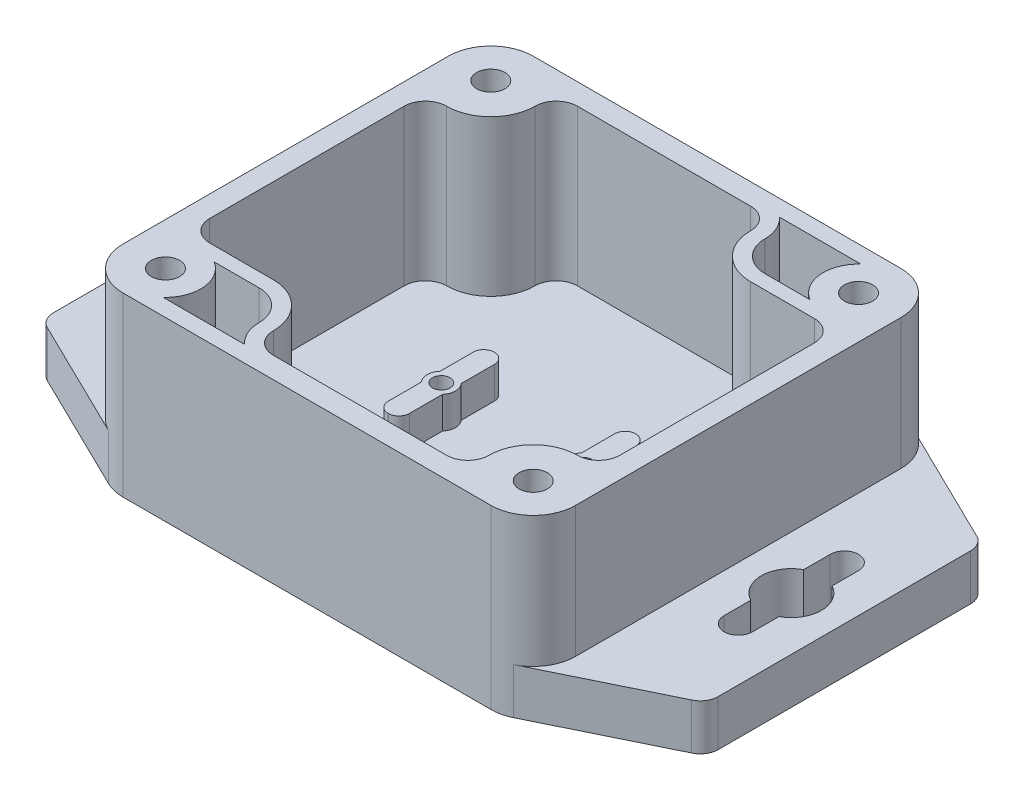
from build123d import *

# Parameters (mm, degrees)
EXTRUDE_1_DEPTH   = 6.5
EXTRUDE_1_2_DEPTH = 6.5
SKETCH_1_3_R      = 2
EXTRUDE_2_DEPTH   = 25
EXTRUDE_3_DEPTH   = 3
SKETCH_1_13_R     = 1.25
EXTRUDE_8_DEPTH   = 7.5
SKETCH_1_12_R     = 1.25
EXTRUDE_7_DEPTH   = 7.5


with BuildPart() as part:
    # Эскиз1 → Бобышка-Вытянуть1 (new body)
    with BuildSketch(Plane(origin=(0, 0, 0), x_dir=(1, 0, 0), z_dir=(0, 1, 0))):
        with BuildLine():
            ThreePointArc((-32, 23), (-31.089439395, 26.177673149), (-28.63413112, 28.390858303))
            Line((-28.63413112, 28.390858303), (-45.533328715, 20.133415836))
            ThreePointArc((-45.533328715, 20.133415836), (-46.601585329, 19.210972795), (-47, 17.856964263))
            Line((-47, 17.856964263), (-47, -17.856964263))
            ThreePointArc((-47, -17.856964263), (-46.601585329, -19.210972795), (-45.533328715, -20.133415836))
            Line((-45.533328715, -20.133415836), (-28.63413112, -28.390858303))
            ThreePointArc((-28.63413112, -28.390858303), (-31.089439395, -26.177673149), (-32, -23))
            Line((-32, -23), (-32, 23))
        make_face()
        with BuildLine():
            Line((-41.5, -7.5), (-41.5, -3.75))
            ThreePointArc((-41.5, -3.75), (-43.75, 0), (-41.5, 3.75))
            Line((-41.5, 3.75), (-41.5, 7.5))
            ThreePointArc((-41.5, 7.5), (-39.5, 9.5), (-37.5, 7.5))
            Line((-37.5, 7.5), (-37.5, 3.75))
            ThreePointArc((-37.5, 3.75), (-35.25, 0), (-37.5, -3.75))
            Line((-37.5, -3.75), (-37.5, -7.5))
            ThreePointArc((-37.5, -7.5), (-39.5, -9.5), (-41.5, -7.5))
        make_face(mode=Mode.SUBTRACT)
    extrude(amount=EXTRUDE_1_DEPTH)



with BuildPart() as body_2:
    # Эскиз1 → Extrude 1 2 (new body)
    with BuildSketch(Plane(origin=(0, 0, 0), x_dir=(1, 0, 0), z_dir=(0, 1, 0))):
        with BuildLine():
            Line((45.533328715, 20.133415836), (28.63413112, 28.390858303))
            ThreePointArc((28.63413112, 28.390858303), (31.089439395, 26.177673149), (32, 23))
            Line((32, 23), (32, -23))
            ThreePointArc((32, -23), (31.089439395, -26.177673149), (28.63413112, -28.390858303))
            Line((28.63413112, -28.390858303), (45.533328715, -20.133415836))
            ThreePointArc((45.533328715, -20.133415836), (46.601585329, -19.210972795), (47, -17.856964263))
            Line((47, -17.856964263), (47, 17.856964263))
            ThreePointArc((47, 17.856964263), (46.601585329, 19.210972795), (45.533328715, 20.133415836))
        make_face()
        with BuildLine():
            Line((37.5, -7.5), (37.5, -3.75))
            ThreePointArc((37.5, -3.75), (35.25, 0), (37.5, 3.75))
            Line((37.5, 3.75), (37.5, 7.5))
            ThreePointArc((37.5, 7.5), (39.5, 9.5), (41.5, 7.5))
            Line((41.5, 7.5), (41.5, 3.75))
            ThreePointArc((41.5, 3.75), (43.75, 0), (41.5, -3.75))
            Line((41.5, -3.75), (41.5, -7.5))
            ThreePointArc((41.5, -7.5), (39.5, -9.5), (37.5, -7.5))
        make_face(mode=Mode.SUBTRACT)
    extrude(amount=EXTRUDE_1_2_DEPTH)


with BuildPart() as part_1:
    add(part.part)

    add(body_2.part)  # Бобышка-Вытянуть2 merges body 2
    # Эскиз1<3> → Бобышка-Вытянуть2 (add)
    with BuildSketch(Plane(origin=(0, 0, 0), x_dir=(1, 0, 0), z_dir=(0, 1, 0))):
        with BuildLine():
            Line((26, 29), (-26, 29))
            ThreePointArc((-26, 29), (-27.351822877, 28.845731341), (-28.63413112, 28.390858303))
            ThreePointArc((-28.63413112, 28.390858303), (-31.089439395, 26.177673149), (-32, 23))
            Line((-32, 23), (-32, -23))
            ThreePointArc((-32, -23), (-31.089439395, -26.177673149), (-28.63413112, -28.390858303))
            ThreePointArc((-28.63413112, -28.390858303), (-27.351822877, -28.845731341), (-26, -29))
            Line((-26, -29), (26, -29))
            ThreePointArc((26, -29), (27.351822877, -28.845731341), (28.63413112, -28.390858303))
            ThreePointArc((28.63413112, -28.390858303), (31.089439395, -26.177673149), (32, -23))
            Line((32, -23), (32, 23))
            ThreePointArc((32, 23), (31.089439395, 26.177673149), (28.63413112, 28.390858303))
            ThreePointArc((28.63413112, 28.390858303), (27.351822877, 28.845731341), (26, 29))
        make_face()
        with Locations((-26, -23)):
            Circle(SKETCH_1_3_R, mode=Mode.SUBTRACT)
        with BuildLine():
            Line((-11.113034344, -26.7), (-22.636965656, -26.7))
            ThreePointArc((-22.636965656, -26.7), (-21.020896599, -22.543349889), (-23.366086562, -18.75))
            Line((-23.366086562, -18.75), (-17, -18.75))
            ThreePointArc((-17, -18.75), (-13.99479618, -19.99479618), (-12.75, -23))
            ThreePointArc((-12.75, -23), (-12.322481368, -25.022971611), (-11.113034344, -26.7))
        make_face(mode=Mode.SUBTRACT)
        with Locations((26, -23)):
            Circle(SKETCH_1_3_R, mode=Mode.SUBTRACT)
        with BuildLine():
            Line((-16.75, 26), (7.75, 26))
            ThreePointArc((7.75, 26), (9.871320344, 25.121320344), (10.75, 23))
            ThreePointArc((10.75, 23), (12.580582618, 18.580582618), (17, 16.75))
            Line((17, 16.75), (26, 16.75))
            ThreePointArc((26, 16.75), (28.121320344, 15.871320344), (29, 13.75))
            Line((29, 13.75), (29, -13.75))
            ThreePointArc((29, -13.75), (28.121320344, -15.871320344), (26, -16.75))
            ThreePointArc((26, -16.75), (21.580582618, -18.580582618), (19.75, -23))
            ThreePointArc((19.75, -23), (18.871320344, -25.121320344), (16.75, -26))
            Line((16.75, -26), (-7.75, -26))
            ThreePointArc((-7.75, -26), (-9.871320344, -25.121320344), (-10.75, -23))
            ThreePointArc((-10.75, -23), (-12.580582618, -18.580582618), (-17, -16.75))
            Line((-17, -16.75), (-26, -16.75))
            ThreePointArc((-26, -16.75), (-28.121320344, -15.871320344), (-29, -13.75))
            Line((-29, -13.75), (-29, 13.75))
            ThreePointArc((-29, 13.75), (-28.121320344, 15.871320344), (-26, 16.75))
            ThreePointArc((-26, 16.75), (-21.580582618, 18.580582618), (-19.75, 23))
            ThreePointArc((-19.75, 23), (-18.871320344, 25.121320344), (-16.75, 26))
        make_face(mode=Mode.SUBTRACT)
        with Locations((-26, 23)):
            Circle(SKETCH_1_3_R, mode=Mode.SUBTRACT)
        with BuildLine():
            Line((23.366086562, 18.75), (17, 18.75))
            ThreePointArc((17, 18.75), (13.99479618, 19.99479618), (12.75, 23))
            ThreePointArc((12.75, 23), (12.322481368, 25.022971611), (11.113034344, 26.7))
            Line((11.113034344, 26.7), (22.636965656, 26.7))
            ThreePointArc((22.636965656, 26.7), (21.020896599, 22.543349889), (23.366086562, 18.75))
        make_face(mode=Mode.SUBTRACT)
        with Locations((26, 23)):
            Circle(SKETCH_1_3_R, mode=Mode.SUBTRACT)
    extrude(amount=EXTRUDE_2_DEPTH)

    # Эскиз1<4> → Бобышка-Вытянуть3 (add)
    with BuildSketch(Plane(origin=(0, 0, 0), x_dir=(1, 0, 0), z_dir=(0, 1, 0))):
        with BuildLine():
            Line((26, 29), (-26, 29))
            ThreePointArc((-26, 29), (-30.242640687, 27.242640687), (-32, 23))
            Line((-32, 23), (-32, -23))
            ThreePointArc((-32, -23), (-30.242640687, -27.242640687), (-26, -29))
            Line((-26, -29), (26, -29))
            ThreePointArc((26, -29), (30.242640687, -27.242640687), (32, -23))
            Line((32, -23), (32, 23))
            ThreePointArc((32, 23), (30.242640687, 27.242640687), (26, 29))
        make_face()
    extrude(amount=EXTRUDE_3_DEPTH)

    # Эскиз1<13> → Бобышка-Вытянуть8 (add)
    # profile 1 of 2: a face of its own
    with BuildSketch(Plane(origin=(0, 0, 0), x_dir=(1, 0, 0), z_dir=(0, 1, 0))):
        with BuildLine():
            Line((-11.5, 1.322875656), (-11.5, 6.01))
            ThreePointArc((-11.5, 6.01), (-11.063589104, 7.063589104), (-10.01, 7.5))
            Line((-10.01, 7.5), (-9.99, 7.5))
            ThreePointArc((-9.99, 7.5), (-8.936410896, 7.063589104), (-8.5, 6.01))
            Line((-8.5, 6.01), (-8.5, 1.322875656))
            ThreePointArc((-8.5, 1.322875656), (-8, 0), (-8.5, -1.322875656))
            Line((-8.5, -1.322875656), (-8.5, -6.01))
            ThreePointArc((-8.5, -6.01), (-8.936410896, -7.063589104), (-9.99, -7.5))
            Line((-9.99, -7.5), (-10.01, -7.5))
            ThreePointArc((-10.01, -7.5), (-11.063589104, -7.063589104), (-11.5, -6.01))
            Line((-11.5, -6.01), (-11.5, -1.322875656))
            ThreePointArc((-11.5, -1.322875656), (-12, 0), (-11.5, 1.322875656))
        make_face()
        with Locations((-10, 0)):
            Circle(SKETCH_1_13_R, mode=Mode.SUBTRACT)
    # profile 2 of 2: a face of its own
    with BuildSketch(Plane(origin=(0, 0, 0), x_dir=(1, 0, 0), z_dir=(0, 1, 0))):
        with BuildLine():
            Line((8.5, -6.01), (8.5, -1.322875656))
            ThreePointArc((8.5, -1.322875656), (8, 0), (8.5, 1.322875656))
            Line((8.5, 1.322875656), (8.5, 6.01))
            ThreePointArc((8.5, 6.01), (8.936410896, 7.063589104), (9.99, 7.5))
            Line((9.99, 7.5), (10.01, 7.5))
            ThreePointArc((10.01, 7.5), (11.063589104, 7.063589104), (11.5, 6.01))
            Line((11.5, 6.01), (11.5, 1.322875656))
            ThreePointArc((11.5, 1.322875656), (12, 0), (11.5, -1.322875656))
            Line((11.5, -1.322875656), (11.5, -6.01))
            ThreePointArc((11.5, -6.01), (11.063589104, -7.063589104), (10.01, -7.5))
            Line((10.01, -7.5), (9.99, -7.5))
            ThreePointArc((9.99, -7.5), (8.936410896, -7.063589104), (8.5, -6.01))
        make_face()
        with Locations((10, 0)):
            Circle(SKETCH_1_13_R, mode=Mode.SUBTRACT)
    extrude(amount=EXTRUDE_8_DEPTH)

    # Эскиз1<12> → Бобышка-Вытянуть7 (add)
    # profile 1 of 2: a face of its own
    with BuildSketch(Plane(origin=(0, 0, 0), x_dir=(1, 0, 0), z_dir=(0, 1, 0))):
        with BuildLine():
            Line((-11.5, 6.01), (-11.5, 1.322875656))
            ThreePointArc((-11.5, 1.322875656), (-12, 0), (-11.5, -1.322875656))
            Line((-11.5, -1.322875656), (-11.5, -6.01))
            ThreePointArc((-11.5, -6.01), (-11.063589104, -7.063589104), (-10.01, -7.5))
            Line((-10.01, -7.5), (-9.99, -7.5))
            ThreePointArc((-9.99, -7.5), (-8.936410896, -7.063589104), (-8.5, -6.01))
            Line((-8.5, -6.01), (-8.5, -1.322875656))
            ThreePointArc((-8.5, -1.322875656), (-8, 0), (-8.5, 1.322875656))
            Line((-8.5, 1.322875656), (-8.5, 6.01))
            ThreePointArc((-8.5, 6.01), (-8.936410896, 7.063589104), (-9.99, 7.5))
            Line((-9.99, 7.5), (-10.01, 7.5))
            ThreePointArc((-10.01, 7.5), (-11.063589104, 7.063589104), (-11.5, 6.01))
        make_face()
        with Locations((-10, 0)):
            Circle(SKETCH_1_12_R, mode=Mode.SUBTRACT)
    # profile 2 of 2: a face of its own
    with BuildSketch(Plane(origin=(0, 0, 0), x_dir=(1, 0, 0), z_dir=(0, 1, 0))):
        with BuildLine():
            Line((8.5, -1.322875656), (8.5, -6.01))
            ThreePointArc((8.5, -6.01), (8.936410896, -7.063589104), (9.99, -7.5))
            Line((9.99, -7.5), (10.01, -7.5))
            ThreePointArc((10.01, -7.5), (11.063589104, -7.063589104), (11.5, -6.01))
            Line((11.5, -6.01), (11.5, -1.322875656))
            ThreePointArc((11.5, -1.322875656), (12, 0), (11.5, 1.322875656))
            Line((11.5, 1.322875656), (11.5, 6.01))
            ThreePointArc((11.5, 6.01), (11.063589104, 7.063589104), (10.01, 7.5))
            Line((10.01, 7.5), (9.99, 7.5))
            ThreePointArc((9.99, 7.5), (8.936410896, 7.063589104), (8.5, 6.01))
            Line((8.5, 6.01), (8.5, 1.322875656))
            ThreePointArc((8.5, 1.322875656), (8, 0), (8.5, -1.322875656))
        make_face()
        with Locations((10, 0)):
            Circle(SKETCH_1_12_R, mode=Mode.SUBTRACT)
    extrude(amount=EXTRUDE_7_DEPTH)


solid = part_1.part
